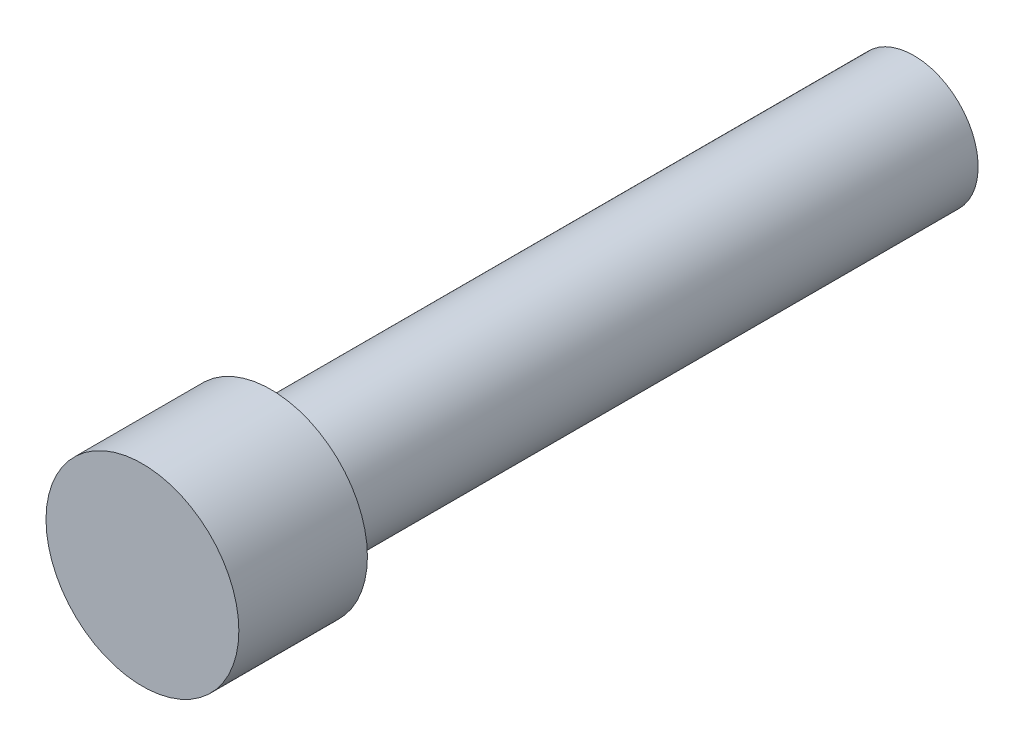
from build123d import *

# Parameters (mm, degrees)
SKETCH_1_R      = 1.5
EXTRUDE_1_DEPTH = 2
SKETCH_2_R      = 1
EXTRUDE_3_DEPTH = 10


with BuildPart() as part:
    # 草图1 → 凸台-拉伸1 (new body)
    with BuildSketch(Plane.XY):
        Circle(SKETCH_1_R)
    extrude(amount=EXTRUDE_1_DEPTH)

    # 草图2 → 凸台-拉伸3 (add)
    with BuildSketch(Plane(origin=(0, 0, 0), x_dir=(-1, 0, 0), z_dir=(0, 0, -1))):
        Circle(SKETCH_2_R)
    extrude(amount=EXTRUDE_3_DEPTH)


solid = part.part
